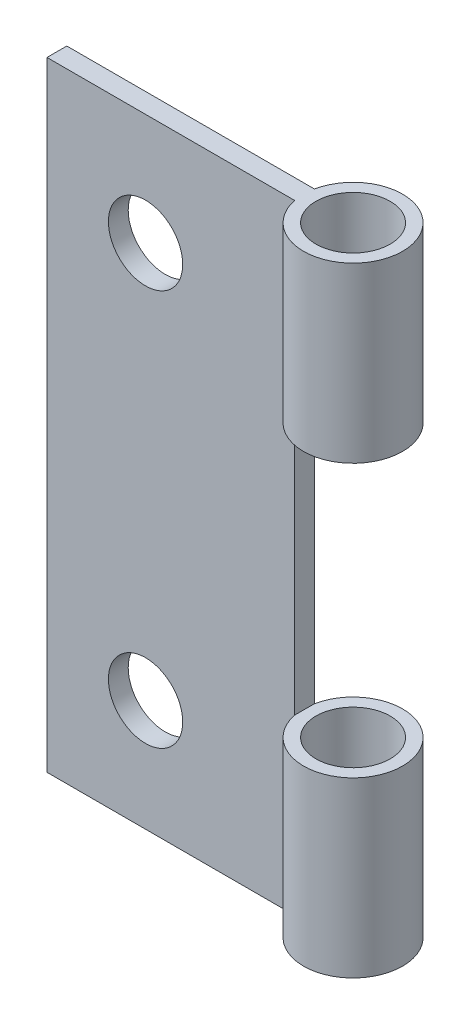
from build123d import *

# Parameters (mm, degrees)
SKETCH_1_W          = 10
SKETCH_1_H          = 25
EXTRUDE_1_DEPTH     = 0.8
SKETCH_2_R          = 2
SKETCH_2_R_2        = 1.5
EXTRUDE_2_DEPTH     = 7
SKETCH_3_R          = 1.5
CUT_EXTRUDE_1_DEPTH = 0.8


with BuildPart() as part:
    # 草图1 → 凸台-拉伸1 (new body)
    with BuildSketch(Plane.XY):
        Rectangle(SKETCH_1_W, SKETCH_1_H)
    extrude(amount=EXTRUDE_1_DEPTH)

    # 草图2 → 凸台-拉伸2 (add)
    with BuildSketch(Plane.XZ.offset(12.5)):
        with Locations((6.959591794, 0.4)):
            Circle(SKETCH_2_R)
        with Locations(Location((6.959591794, 0.4, 0), (0, 0, 270))):
            Circle(SKETCH_2_R_2, mode=Mode.SUBTRACT)
    extrude_2 = extrude(amount=-EXTRUDE_2_DEPTH)

    # 镜向1: 凸台-拉伸2 across plane
    add(extrude_2.mirror(Plane.ZX))

    # 草图3 → 切除-拉伸1 (cut)
    with BuildSketch(Plane.XY.offset(0.8)):
        with Locations((-1.020204103, 8)):
            Circle(SKETCH_3_R)
        with Locations((-1.020204103, -8)):
            Circle(SKETCH_3_R)
    extrude(amount=-CUT_EXTRUDE_1_DEPTH, mode=Mode.SUBTRACT)


solid = part.part
